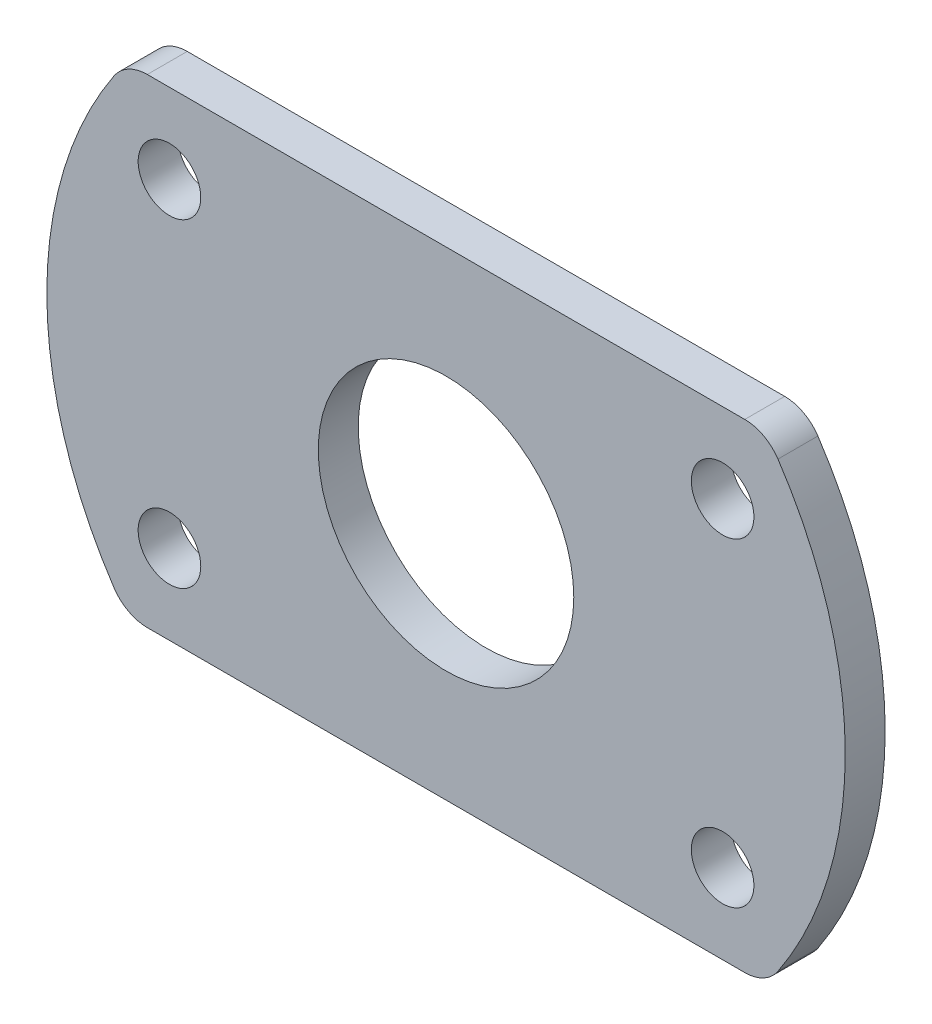
from build123d import *

# Parameters (mm, degrees)
SKETCH1_R           = 2.4892
SKETCH1_R_2         = 10.16
BOSS_EXTRUDE1_DEPTH = 1.5875
FILLET1_R           = 3.175


with BuildPart() as part:
    # Sketch1 → Boss-Extrude1 (new, symmetric)
    with BuildSketch(Plane.XY):
        with BuildLine():
            Line((-25.4, 19.05), (0, 19.05))
            Line((0, 19.05), (25.4, 19.05))
            ThreePointArc((25.4, 19.05), (31.75, 0), (25.4, -19.05))
            Line((25.4, -19.05), (0, -19.05))
            Line((0, -19.05), (-25.4, -19.05))
            ThreePointArc((-25.4, -19.05), (-31.75, 0), (-25.4, 19.05))
        make_face()
        with Locations((21.997045256, 12.7)):
            Circle(SKETCH1_R, mode=Mode.SUBTRACT)
        with Locations((21.997045256, -12.7)):
            Circle(SKETCH1_R, mode=Mode.SUBTRACT)
        with Locations((-21.997045256, -12.7)):
            Circle(SKETCH1_R, mode=Mode.SUBTRACT)
        with Locations((-21.997045256, 12.7)):
            Circle(SKETCH1_R, mode=Mode.SUBTRACT)
        Circle(SKETCH1_R_2, mode=Mode.SUBTRACT)
    extrude(amount=BOSS_EXTRUDE1_DEPTH, both=True)

    # Fillet1
    fillet1_edges = [part.edges().sort_by_distance(p)[0] for p in [
        (-25.4, 19.05, 0),
        (25.4, 19.05, 0),
        (25.4, -19.05, 0),
        (-25.4, -19.05, 0),
    ]]
    fillet(fillet1_edges, radius=FILLET1_R)


solid = part.part
